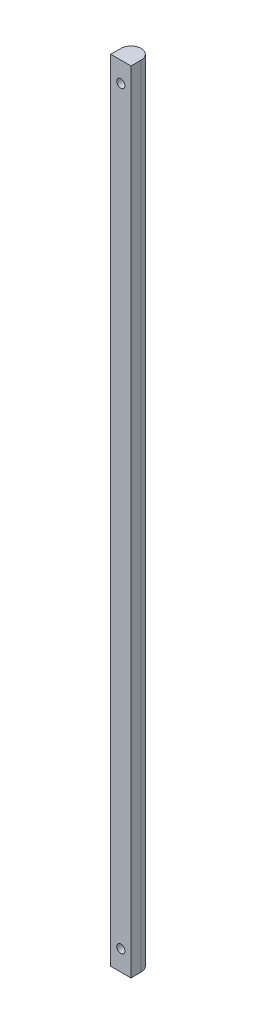
from build123d import *

# Parameters (mm, degrees)
BOSS_EXTRUDE1_DEPTH   = 123.825
F_5_40_TAPPED_HOLE1_D = 2.5781


with BuildPart() as part:
    # Sketch1 → Boss-Extrude1 (new, symmetric)
    with BuildSketch(Plane(origin=(0, 0, 0), x_dir=(1, 0, 0), z_dir=(0, 1, 0))):
        with BuildLine():
            Line((-3.175, 3.175), (-3.175, 0))
            Line((-3.175, 0), (3.175, 0))
            Line((3.175, 0), (3.175, 3.175))
            ThreePointArc((3.175, 3.175), (0, 6.35), (-3.175, 3.175))
        make_face()
    extrude(amount=BOSS_EXTRUDE1_DEPTH, both=True)

    # #5-40 Tapped Hole1 (through all)
    with Locations(Plane.XY):
        with Locations((0, 117.475), (0, -117.475)):
            Hole(F_5_40_TAPPED_HOLE1_D / 2)


solid = part.part
